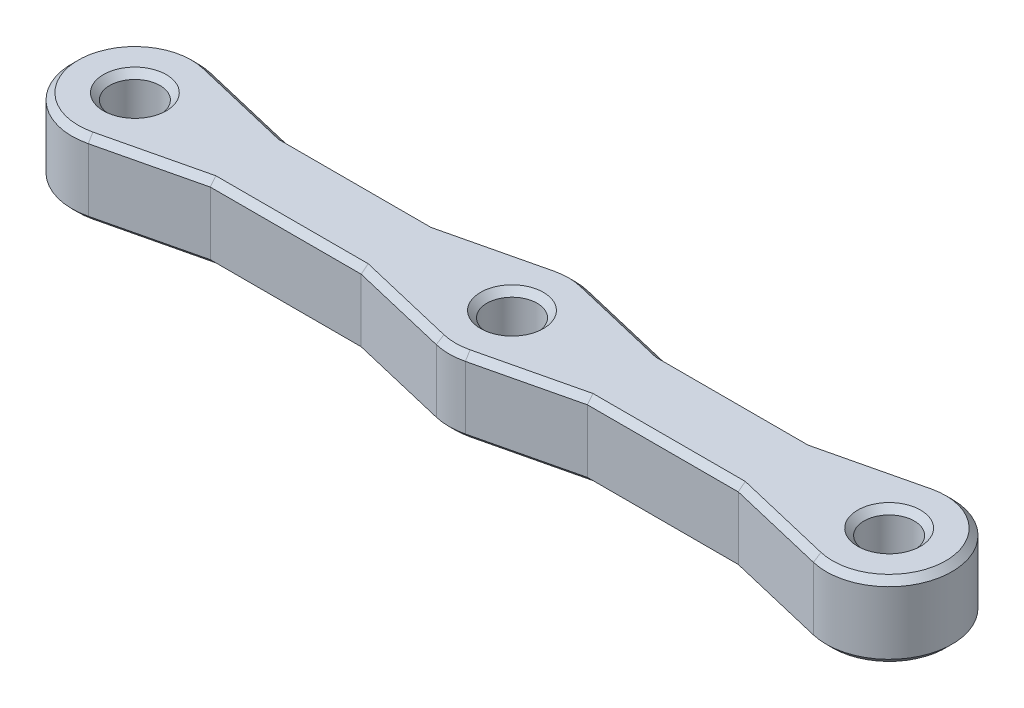
from build123d import *

# Parameters (mm, degrees)
SKETCH_1_R      = 1
EXTRUDE_1_DEPTH = 3
EXTRUDE_2_DEPTH = 3
CHAMFER_1_SIZE  = 0.25


with BuildPart() as part:
    # 草图1 → 凸台-拉伸1 (new body)
    with BuildSketch(Plane(origin=(0, 0, 0), x_dir=(1, 0, 0), z_dir=(0, 1, 0))):
        with BuildLine():
            Line((-13, 1.5), (-2, 1.5))
            ThreePointArc((-2, 1.5), (0, 2.5), (2, 1.5))
            Line((2, 1.5), (13, 1.5))
            ThreePointArc((13, 1.5), (17.5, 0), (13, -1.5))
            Line((13, -1.5), (2, -1.5))
            ThreePointArc((2, -1.5), (0, -2.5), (-2, -1.5))
            Line((-2, -1.5), (-13, -1.5))
            ThreePointArc((-13, -1.5), (-17.5, 0), (-13, 1.5))
        make_face()
        with Locations(Location((-15, 0, 0), (0, 0, 270))):
            Circle(SKETCH_1_R, mode=Mode.SUBTRACT)
        with Locations(Location((0, 0, 0), (0, 0, 270))):
            Circle(SKETCH_1_R, mode=Mode.SUBTRACT)
        with Locations(Location((15, 0, 0), (0, 0, 270))):
            Circle(SKETCH_1_R, mode=Mode.SUBTRACT)
    extrude(amount=EXTRUDE_1_DEPTH)

    # 草图2 → 凸台-拉伸2 (add)
    with BuildSketch(Plane(origin=(0, 0, 0), x_dir=(1, 0, 0), z_dir=(0, 1, 0))):
        with BuildLine():
            Line((4.5, 1.5), (0.578145188, 2.432231104))
            ThreePointArc((0.578145188, 2.432231104), (1.370755945, 2.090700395), (2, 1.5))
            Line((2, 1.5), (4.5, 1.5))
        make_face()
        with BuildLine():
            Line((4.5, -1.5), (0.578145188, -2.432231104))
            ThreePointArc((0.578145188, -2.432231104), (1.370755945, -2.090700395), (2, -1.5))
            Line((2, -1.5), (4.5, -1.5))
        make_face()
        with BuildLine():
            Line((10.5, 1.5), (14.421854812, 2.432231104))
            ThreePointArc((14.421854812, 2.432231104), (13.629244055, 2.090700395), (13, 1.5))
            Line((13, 1.5), (10.5, 1.5))
        make_face()
        with BuildLine():
            Line((10.5, -1.5), (14.421854812, -2.432231104))
            ThreePointArc((14.421854812, -2.432231104), (13.629244055, -2.090700395), (13, -1.5))
            Line((13, -1.5), (10.5, -1.5))
        make_face()
        with BuildLine():
            Line((-4.5, 1.5), (-2, 1.5))
            ThreePointArc((-2, 1.5), (-1.370755945, 2.090700395), (-0.578145188, 2.432231104))
            Line((-0.578145188, 2.432231104), (-4.5, 1.5))
        make_face()
        with BuildLine():
            Line((-10.5, -1.5), (-13, -1.5))
            ThreePointArc((-13, -1.5), (-13.629244055, -2.090700395), (-14.421854812, -2.432231104))
            Line((-14.421854812, -2.432231104), (-10.5, -1.5))
        make_face()
        with BuildLine():
            Line((-13, 1.5), (-10.5, 1.5))
            Line((-10.5, 1.5), (-14.421854812, 2.432231104))
            ThreePointArc((-14.421854812, 2.432231104), (-13.629244055, 2.090700395), (-13, 1.5))
        make_face()
        with BuildLine():
            Line((-2, -1.5), (-4.5, -1.5))
            Line((-4.5, -1.5), (-0.578145188, -2.432231104))
            ThreePointArc((-0.578145188, -2.432231104), (-1.370755945, -2.090700395), (-2, -1.5))
        make_face()
    extrude(amount=EXTRUDE_2_DEPTH)

    # 倒角1
    chamfer_1_edges = [part.edges().sort_by_distance(p)[0] for p in [
        (-7.5, 0, -1.5),
        (-7.5, 3, -1.5),
        (-2.539072594, 0, -1.966115552),
        (-2.539072594, 3, -1.966115552),
        (-15, 0, -1),
        (-15, 3, -1),
        (0, 0, -1),
        (0, 3, -1),
        (15, 0, -1),
        (15, 3, -1),
        (0, 0, -2.5),
        (0, 3, -2.5),
        (2.539072594, 0, -1.966115552),
        (2.539072594, 3, -1.966115552),
        (-17.5, 0, 0),
        (-17.5, 3, 0),
        (-12.460927406, 0, -1.966115552),
        (-12.460927406, 3, -1.966115552),
        (-7.5, 0, 1.5),
        (-7.5, 3, 1.5),
        (-12.460927406, 0, 1.966115552),
        (-12.460927406, 3, 1.966115552),
        (0, 0, 2.5),
        (0, 3, 2.5),
        (-2.539072594, 0, 1.966115552),
        (-2.539072594, 3, 1.966115552),
        (7.5, 0, 1.5),
        (7.5, 3, 1.5),
        (2.539072594, 0, 1.966115552),
        (2.539072594, 3, 1.966115552),
        (17.5, 0, 0),
        (17.5, 3, 0),
        (12.460927406, 0, 1.966115552),
        (12.460927406, 3, 1.966115552),
        (7.5, 0, -1.5),
        (7.5, 3, -1.5),
        (12.460927406, 0, -1.966115552),
        (12.460927406, 3, -1.966115552),
    ]]
    chamfer(chamfer_1_edges, length=CHAMFER_1_SIZE)


solid = part.part
